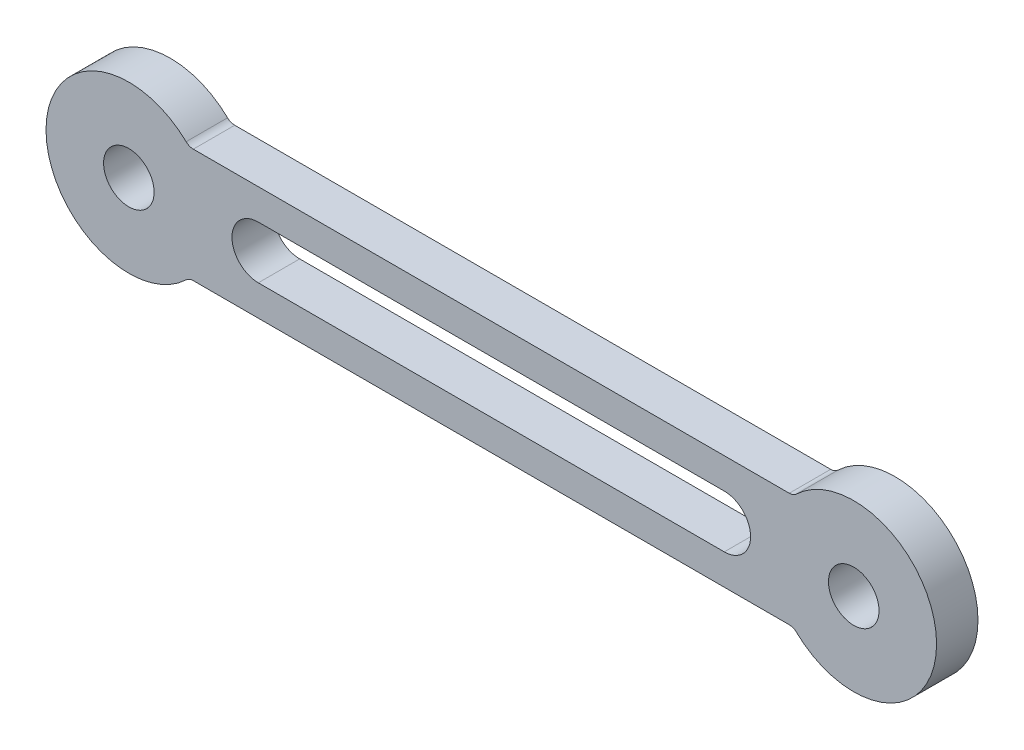
from build123d import *

# Parameters (mm, degrees)
SKETCH_1_R      = 2.44
EXTRUDE_1_DEPTH = 4
FILLET_2_R      = 1
FILLET_4_R      = 1
FILLET_5_R      = 1
FILLET_6_R      = 1


with BuildPart() as part:
    # 草图1 → 凸台-拉伸1 (new body)
    with BuildSketch(Plane.XY):
        with BuildLine():
            Line((-29.190524981, -5.5), (29.190524981, -5.5))
            ThreePointArc((29.190524981, -5.5), (43, 0), (29.190524981, 5.5))
            Line((29.190524981, 5.5), (-29.190524981, 5.5))
            ThreePointArc((-29.190524981, 5.5), (-43, 0), (-29.190524981, -5.5))
        make_face()
        with Locations((35, 0)):
            Circle(SKETCH_1_R, mode=Mode.SUBTRACT)
        with Locations((-35, 0)):
            Circle(SKETCH_1_R, mode=Mode.SUBTRACT)
        with BuildLine():
            ThreePointArc((22.5, -2.540734009), (25.040734009, 0), (22.5, 2.540734009))
            Line((22.5, 2.540734009), (-22.5, 2.540734009))
            ThreePointArc((-22.5, 2.540734009), (-25.040734009, 0), (-22.5, -2.540734009))
            Line((-22.5, -2.540734009), (22.5, -2.540734009))
        make_face(mode=Mode.SUBTRACT)
    extrude(amount=EXTRUDE_1_DEPTH)

    # 圆角2
    fillet_2_edges = [part.edges().sort_by_distance(p)[0] for p in [
        (-29.190524981, 5.5, 2),
    ]]
    fillet(fillet_2_edges, radius=FILLET_2_R)

    # 圆角4
    fillet_4_edges = [part.edges().sort_by_distance(p)[0] for p in [
        (-29.190524981, -5.5, 2),
    ]]
    fillet(fillet_4_edges, radius=FILLET_4_R)

    # 圆角5
    fillet_5_edges = [part.edges().sort_by_distance(p)[0] for p in [
        (29.190524981, 5.5, 2),
    ]]
    fillet(fillet_5_edges, radius=FILLET_5_R)

    # 圆角6
    fillet_6_edges = [part.edges().sort_by_distance(p)[0] for p in [
        (29.190524981, -5.5, 2),
    ]]
    fillet(fillet_6_edges, radius=FILLET_6_R)


solid = part.part
